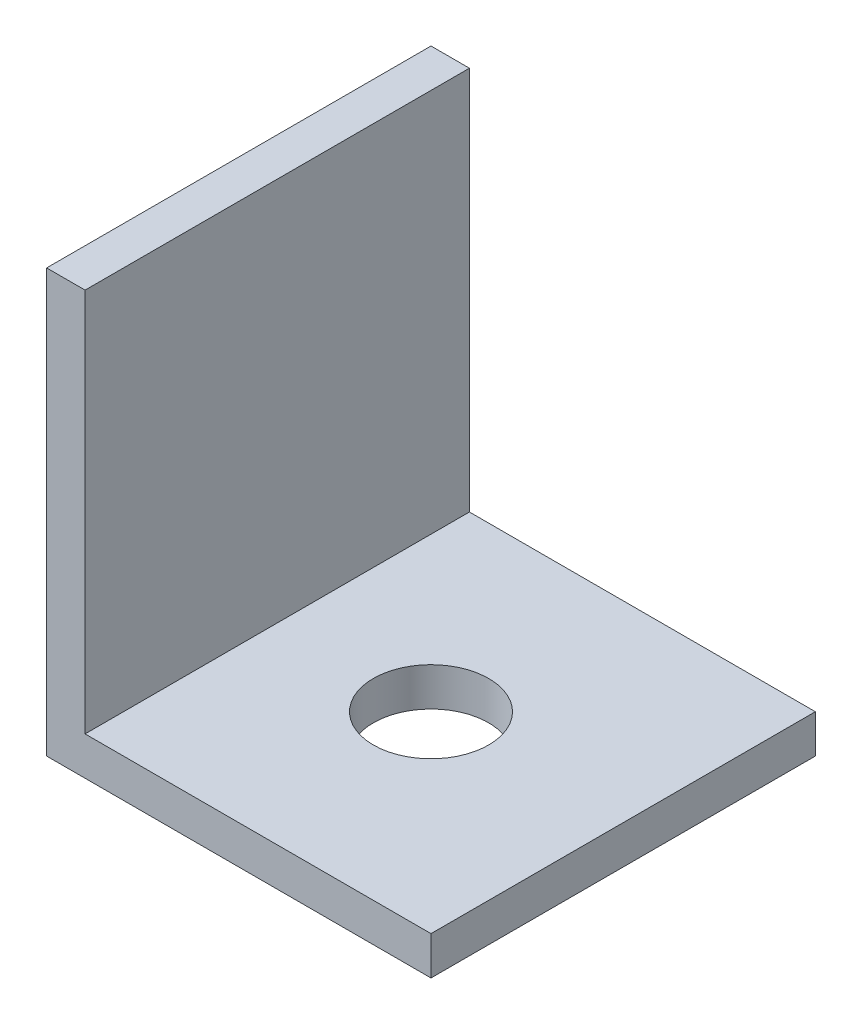
from build123d import *

# Parameters (mm, degrees)
SKETCH_2_W      = 20
SKETCH_2_H      = 20
SKETCH_2_R      = 3
EXTRUDE_1_DEPTH = 2
SKETCH_3_W      = 2
SKETCH_3_H      = 20
EXTRUDE_2_DEPTH = 20


with BuildPart() as part:
    # ｽｹｯﾁ2 → ﾎﾞｽ - 押し出し1 (new body)
    with BuildSketch(Plane(origin=(0, 0, 0), x_dir=(1, 0, 0), z_dir=(0, 1, 0))):
        Rectangle(SKETCH_2_W, SKETCH_2_H)
        with Locations(Location((0, 0, 0), (0, 0, 270))):
            Circle(SKETCH_2_R, mode=Mode.SUBTRACT)
    extrude(amount=EXTRUDE_1_DEPTH)

    # ｽｹｯﾁ3 → ﾎﾞｽ - 押し出し2 (add)
    with BuildSketch(Plane(origin=(0, 2, 0), x_dir=(1, 0, 0), z_dir=(0, 1, 0))):
        with Locations((-9, 0)):
            Rectangle(SKETCH_3_W, SKETCH_3_H)
    extrude(amount=EXTRUDE_2_DEPTH)


solid = part.part
